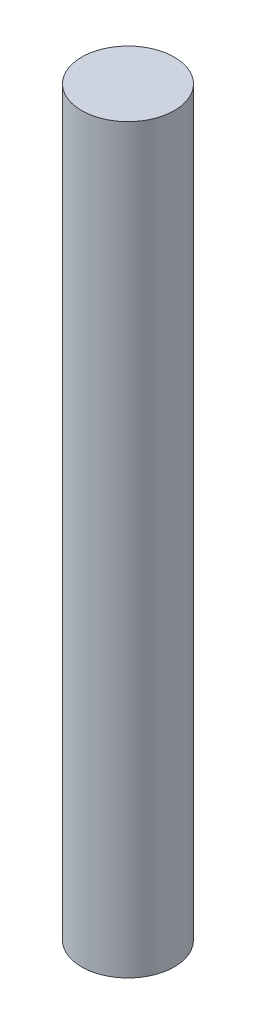
from build123d import *

# Parameters (mm, degrees)
SKETCH_1_R      = 2.5
EXTRUDE_1_DEPTH = 40


with BuildPart() as part:
    # 草图1 → 凸台-拉伸1 (new body)
    with BuildSketch(Plane(origin=(0, 0, 0), x_dir=(1, 0, 0), z_dir=(0, 1, 0))):
        with Locations(Location((0, 0, 0), (0, 0, 270))):
            Circle(SKETCH_1_R)
    extrude(amount=EXTRUDE_1_DEPTH)


solid = part.part
